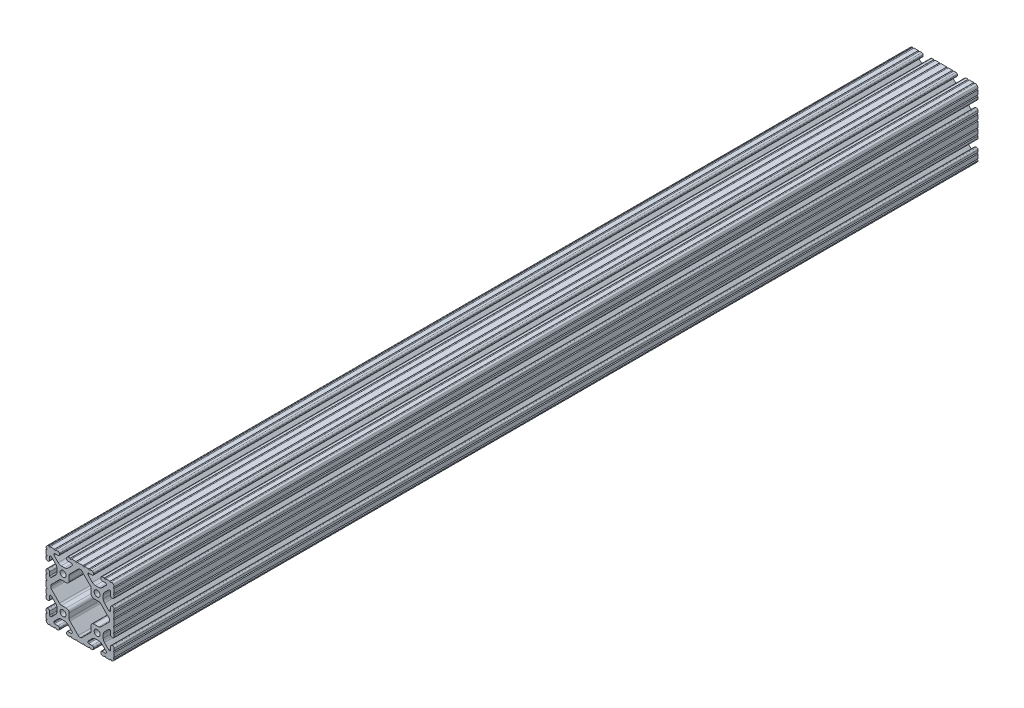
from build123d import *

# Parameters (mm, degrees)
SKETCH1_R           = 3.3274
BOSS_EXTRUDE1_DEPTH = 965.2


with BuildPart() as part:
    # Sketch1 → Boss-Extrude1 (new body)
    with BuildSketch(Plane(origin=(0, 0, -609.6), x_dir=(-1, 0, 0), z_dir=(0, 0, -1))):
        with BuildLine():
            Line((36.525200182, -23.055396049), (35.610799999, -23.055396049))
            ThreePointArc((35.610799999, -23.055396049), (34.49724824, -23.51664429), (34.035999999, -24.630196049))
            Line((34.035999999, -24.630196049), (34.035999999, -28.448000001))
            ThreePointArc((34.035999999, -28.448000001), (33.775617927, -29.07661793), (33.146999999, -29.337000001))
            Line((33.146999999, -29.337000001), (32.664287243, -29.337000001))
            ThreePointArc((32.664287243, -29.337000001), (32.324081166, -29.269328696), (32.035668541, -29.076617157))
            Line((32.035668541, -29.076617157), (27.197580079, -24.238516795))
            ThreePointArc((27.197580079, -24.238516795), (26.167955878, -22.697572205), (25.806399999, -20.879905136))
            Line((25.806399999, -20.879905136), (25.806399999, -17.220094864))
            ThreePointArc((25.806399999, -17.220094864), (26.167955878, -15.402427795), (27.197580079, -13.861483205))
            Line((27.197580079, -13.861483205), (31.948944539, -9.110107059))
            ThreePointArc((31.948944539, -9.110107059), (32.333417094, -8.853210197), (32.786933647, -8.763000001))
            Line((32.786933647, -8.763000001), (33.060275786, -8.763000001))
            ThreePointArc((33.060275786, -8.763000001), (33.750216993, -9.048783007), (34.035999999, -9.738724214))
            Line((34.035999999, -9.738724214), (34.035999999, -13.469803585))
            ThreePointArc((34.035999999, -13.469803585), (34.497248347, -14.583355602), (35.610800365, -15.044603951))
            Line((35.610800365, -15.044603951), (36.525199999, -15.044603951))
            ThreePointArc((36.525199999, -15.044603951), (37.638751758, -14.58335571), (38.099999999, -13.469803951))
            Line((38.099999999, -13.469803951), (38.099999999, -11.075039291))
            ThreePointArc((38.099999999, -11.075039291), (37.117000249, -10.313517274), (38.099999999, -9.551995256))
            Line((38.099999999, -9.551995256), (38.099999999, -4.723759309))
            ThreePointArc((38.099999999, -4.723759309), (37.117000249, -3.962237291), (38.099999999, -3.200715274))
            Line((38.099999999, -3.200715274), (38.099999999, 3.200715274))
            ThreePointArc((38.099999999, 3.200715274), (37.117000249, 3.962237291), (38.099999999, 4.723759309))
            Line((38.099999999, 4.723759309), (38.099999999, 9.551995254))
            ThreePointArc((38.099999999, 9.551995254), (37.117000249, 10.313517271), (38.099999999, 11.075039288))
            Line((38.099999999, 11.075039288), (38.099999999, 13.469803951))
            ThreePointArc((38.099999999, 13.469803951), (37.638751758, 14.58335571), (36.525199999, 15.044603951))
            Line((36.525199999, 15.044603951), (35.610800365, 15.044603951))
            ThreePointArc((35.610800365, 15.044603951), (34.497248347, 14.583355602), (34.035999999, 13.469803585))
            Line((34.035999999, 13.469803585), (34.035999999, 9.738724211))
            ThreePointArc((34.035999999, 9.738724211), (33.750216993, 9.048783004), (33.060275786, 8.762999999))
            Line((33.060275786, 8.762999999), (32.78693365, 8.762999999))
            ThreePointArc((32.78693365, 8.762999999), (32.333417097, 8.853210195), (31.948944542, 9.110107056))
            Line((31.948944542, 9.110107056), (27.197580079, 13.861483205))
            ThreePointArc((27.197580079, 13.861483205), (26.167955878, 15.402427795), (25.806399999, 17.220094864))
            Line((25.806399999, 17.220094864), (25.806399999, 20.879905136))
            ThreePointArc((25.806399999, 20.879905136), (26.167955878, 22.697572205), (27.19758008, 24.238516796))
            Line((27.19758008, 24.238516796), (32.035668541, 29.076617154))
            ThreePointArc((32.035668541, 29.076617154), (32.324081166, 29.269328694), (32.664287243, 29.336999999))
            Line((32.664287243, 29.336999999), (33.146999999, 29.336999999))
            ThreePointArc((33.146999999, 29.336999999), (33.775617927, 29.076617927), (34.035999999, 28.447999999))
            Line((34.035999999, 28.447999999), (34.035999999, 24.630196049))
            ThreePointArc((34.035999999, 24.630196049), (34.49724824, 23.51664429), (35.610799999, 23.055396049))
            Line((35.610799999, 23.055396049), (36.525200182, 23.055396049))
            ThreePointArc((36.525200182, 23.055396049), (37.638751811, 23.516644237), (38.099999999, 24.630195866))
            Line((38.099999999, 24.630195866), (38.099999999, 27.023826138))
            ThreePointArc((38.099999999, 27.023826138), (37.117780707, 27.7845421), (38.099999999, 28.545258063))
            Line((38.099999999, 28.545258063), (38.099999999, 33.373016026))
            ThreePointArc((38.099999999, 33.373016026), (37.141472622, 34.109236775), (38.1, 34.845457522))
            ThreePointArc((38.1, 34.845457522), (37.837757798, 36.120195039), (37.086123087, 37.182631848))
            ThreePointArc((37.086123087, 37.182631848), (36.106286535, 37.843374412), (34.952681874, 38.099999999))
            ThreePointArc((34.952681874, 38.099999999), (34.190730434, 37.320215334), (33.428778993, 38.099999999))
            Line((33.428778993, 38.099999999), (28.601105934, 38.099999999))
            ThreePointArc((28.601105934, 38.099999999), (27.83915858, 37.320219419), (27.077211226, 38.099999999))
            Line((27.077211226, 38.099999999), (24.688799999, 38.099999999))
            ThreePointArc((24.688799999, 38.099999999), (23.57524824, 37.638751758), (23.113999999, 36.525199999))
            Line((23.113999999, 36.525199999), (23.113999999, 35.610799999))
            ThreePointArc((23.113999999, 35.610799999), (23.57524824, 34.49724824), (24.688799999, 34.035999999))
            Line((24.688799999, 34.035999999), (28.447999999, 34.035999999))
            ThreePointArc((28.447999999, 34.035999999), (29.076617927, 33.775617927), (29.336999999, 33.146999999))
            Line((29.336999999, 33.146999999), (29.336999999, 32.720693457))
            ThreePointArc((29.336999999, 32.720693457), (29.326675076, 32.273872753), (29.100231244, 31.888543625))
            Line((29.100231244, 31.888543625), (24.409287498, 27.19758834))
            ThreePointArc((24.409287498, 27.19758834), (22.868340044, 26.167958113), (21.050667578, 25.806399999))
            Line((21.050667578, 25.806399999), (17.049332422, 25.806399999))
            ThreePointArc((17.049332422, 25.806399999), (15.231659956, 26.167958113), (13.690712502, 27.19758834))
            Line((13.690712502, 27.19758834), (9.023381297, 31.864931026))
            ThreePointArc((9.023381297, 31.864931026), (8.830670885, 32.153343115), (8.762999999, 32.493548181))
            Line((8.762999999, 32.493548181), (8.762999999, 33.146999999))
            ThreePointArc((8.762999999, 33.146999999), (9.02338207, 33.775617927), (9.651999999, 34.035999999))
            Line((9.651999999, 34.035999999), (13.411199999, 34.035999999))
            ThreePointArc((13.411199999, 34.035999999), (14.524751758, 34.49724824), (14.985999999, 35.610799999))
            Line((14.985999999, 35.610799999), (14.985999999, 36.525199999))
            ThreePointArc((14.985999999, 36.525199999), (14.524751758, 37.638751758), (13.411199999, 38.099999999))
            Line((13.411199999, 38.099999999), (11.128867073, 38.099999999))
            ThreePointArc((11.128867073, 38.099999999), (10.367071032, 37.320370692), (9.605274992, 38.099999999))
            Line((9.605274992, 38.099999999), (4.777313068, 38.099999999))
            ThreePointArc((4.777313068, 38.099999999), (4.015517027, 37.320370692), (3.253720987, 38.099999999))
            Line((3.253720987, 38.099999999), (-3.253720989, 38.099999999))
            ThreePointArc((-3.253720989, 38.099999999), (-4.01551703, 37.320370692), (-4.777313071, 38.099999999))
            Line((-4.777313071, 38.099999999), (-9.605274992, 38.099999999))
            ThreePointArc((-9.605274992, 38.099999999), (-10.367071032, 37.320370692), (-11.128867073, 38.099999999))
            Line((-11.128867073, 38.099999999), (-13.411200001, 38.099999999))
            ThreePointArc((-13.411200001, 38.099999999), (-14.52475176, 37.638751758), (-14.986000001, 36.525199999))
            Line((-14.986000001, 36.525199999), (-14.986000001, 35.610799999))
            ThreePointArc((-14.986000001, 35.610799999), (-14.52475176, 34.49724824), (-13.411200001, 34.035999999))
            Line((-13.411200001, 34.035999999), (-9.652000001, 34.035999999))
            ThreePointArc((-9.652000001, 34.035999999), (-9.023382073, 33.775617927), (-8.763000001, 33.146999999))
            Line((-8.763000001, 33.146999999), (-8.763000001, 32.493548178))
            ThreePointArc((-8.763000001, 32.493548178), (-8.830670888, 32.153343112), (-9.0233813, 31.864931023))
            Line((-9.0233813, 31.864931023), (-13.690712502, 27.19758834))
            ThreePointArc((-13.690712502, 27.19758834), (-15.231659956, 26.167958113), (-17.049332422, 25.806399999))
            Line((-17.049332422, 25.806399999), (-21.050667578, 25.806399999))
            ThreePointArc((-21.050667578, 25.806399999), (-22.868340044, 26.167958113), (-24.409287498, 27.19758834))
            Line((-24.409287498, 27.19758834), (-29.100231244, 31.888543625))
            ThreePointArc((-29.100231244, 31.888543625), (-29.326675074, 32.273872748), (-29.337000001, 32.720693446))
            Line((-29.337000001, 32.720693446), (-29.337000001, 33.146999999))
            ThreePointArc((-29.337000001, 33.146999999), (-29.07661793, 33.775617927), (-28.448000001, 34.035999999))
            Line((-28.448000001, 34.035999999), (-24.688800001, 34.035999999))
            ThreePointArc((-24.688800001, 34.035999999), (-23.575248242, 34.49724824), (-23.114000001, 35.610799999))
            Line((-23.114000001, 35.610799999), (-23.114000001, 36.525199999))
            ThreePointArc((-23.114000001, 36.525199999), (-23.575248242, 37.638751758), (-24.688800001, 38.099999999))
            Line((-24.688800001, 38.099999999), (-27.077211226, 38.099999999))
            ThreePointArc((-27.077211226, 38.099999999), (-27.83915858, 37.320219419), (-28.601105934, 38.099999999))
            Line((-28.601105934, 38.099999999), (-33.428778993, 38.099999999))
            ThreePointArc((-33.428778993, 38.099999999), (-34.190730434, 37.320215334), (-34.952681874, 38.099999999))
            ThreePointArc((-34.952681874, 38.099999999), (-36.106286561, 37.843374402), (-37.086123128, 37.18263181))
            ThreePointArc((-37.086123128, 37.18263181), (-37.837757809, 36.120195013), (-38.1, 34.845457522))
            ThreePointArc((-38.1, 34.845457522), (-37.141472622, 34.109236773), (-38.100000001, 33.373016026))
            Line((-38.100000001, 33.373016026), (-38.100000001, 28.545258062))
            ThreePointArc((-38.100000001, 28.545258062), (-37.117780707, 27.7845421), (-38.100000001, 27.023826138))
            Line((-38.100000001, 27.023826138), (-38.100000001, 24.630195866))
            ThreePointArc((-38.100000001, 24.630195866), (-37.638751814, 23.516644237), (-36.525200184, 23.055396049))
            Line((-36.525200184, 23.055396049), (-35.610800001, 23.055396049))
            ThreePointArc((-35.610800001, 23.055396049), (-34.497248242, 23.51664429), (-34.036000001, 24.630196049))
            Line((-34.036000001, 24.630196049), (-34.036000001, 28.447999999))
            ThreePointArc((-34.036000001, 28.447999999), (-33.77561793, 29.076617927), (-33.147000001, 29.336999999))
            Line((-33.147000001, 29.336999999), (-32.664287243, 29.336999999))
            ThreePointArc((-32.664287243, 29.336999999), (-32.324081166, 29.269328694), (-32.035668541, 29.076617154))
            Line((-32.035668541, 29.076617154), (-27.197580082, 24.238516798))
            ThreePointArc((-27.197580082, 24.238516798), (-26.16795588, 22.697572208), (-25.806400001, 20.879905138))
            Line((-25.806400001, 20.879905138), (-25.806400001, 17.220094862))
            ThreePointArc((-25.806400001, 17.220094862), (-26.16795588, 15.402427793), (-27.197580082, 13.861483203))
            Line((-27.197580082, 13.861483203), (-31.948944542, 9.110107056))
            ThreePointArc((-31.948944542, 9.110107056), (-32.333417097, 8.853210195), (-32.78693365, 8.762999999))
            Line((-32.78693365, 8.762999999), (-33.060275789, 8.762999999))
            ThreePointArc((-33.060275789, 8.762999999), (-33.750216996, 9.048783004), (-34.036000001, 9.738724211))
            Line((-34.036000001, 9.738724211), (-34.036000001, 13.469803585))
            ThreePointArc((-34.036000001, 13.469803585), (-34.497248349, 14.583355602), (-35.610800367, 15.044603951))
            Line((-35.610800367, 15.044603951), (-36.525200001, 15.044603951))
            ThreePointArc((-36.525200001, 15.044603951), (-37.63875176, 14.58335571), (-38.100000001, 13.469803951))
            Line((-38.100000001, 13.469803951), (-38.100000001, 11.075039288))
            ThreePointArc((-38.100000001, 11.075039288), (-37.117000249, 10.313517271), (-38.100000001, 9.551995254))
            Line((-38.100000001, 9.551995254), (-38.100000001, 4.723759308))
            ThreePointArc((-38.100000001, 4.723759308), (-37.117000249, 3.962237291), (-38.100000001, 3.200715275))
            Line((-38.100000001, 3.200715275), (-38.100000001, -3.200715275))
            ThreePointArc((-38.100000001, -3.200715275), (-37.117000249, -3.962237291), (-38.100000001, -4.723759308))
            Line((-38.100000001, -4.723759308), (-38.100000001, -9.551995257))
            ThreePointArc((-38.100000001, -9.551995257), (-37.117000249, -10.313517274), (-38.100000001, -11.07503929))
            Line((-38.100000001, -11.07503929), (-38.100000001, -13.469803951))
            ThreePointArc((-38.100000001, -13.469803951), (-37.63875176, -14.58335571), (-36.525200001, -15.044603951))
            Line((-36.525200001, -15.044603951), (-35.610800367, -15.044603951))
            ThreePointArc((-35.610800367, -15.044603951), (-34.497248349, -14.583355602), (-34.036000001, -13.469803585))
            Line((-34.036000001, -13.469803585), (-34.036000001, -9.738724214))
            ThreePointArc((-34.036000001, -9.738724214), (-33.750216996, -9.048783007), (-33.060275789, -8.763000001))
            Line((-33.060275789, -8.763000001), (-32.786933647, -8.763000001))
            ThreePointArc((-32.786933647, -8.763000001), (-32.333417094, -8.853210197), (-31.948944539, -9.110107059))
            Line((-31.948944539, -9.110107059), (-27.197580082, -13.861483203))
            ThreePointArc((-27.197580082, -13.861483203), (-26.16795588, -15.402427793), (-25.806400001, -17.220094862))
            Line((-25.806400001, -17.220094862), (-25.806400001, -20.879905138))
            ThreePointArc((-25.806400001, -20.879905138), (-26.16795588, -22.697572207), (-27.197580082, -24.238516797))
            Line((-27.197580082, -24.238516797), (-32.035668541, -29.076617157))
            ThreePointArc((-32.035668541, -29.076617157), (-32.324081166, -29.269328696), (-32.664287243, -29.337000001))
            Line((-32.664287243, -29.337000001), (-33.147000001, -29.337000001))
            ThreePointArc((-33.147000001, -29.337000001), (-33.77561793, -29.07661793), (-34.036000001, -28.448000001))
            Line((-34.036000001, -28.448000001), (-34.036000001, -24.630196049))
            ThreePointArc((-34.036000001, -24.630196049), (-34.497248242, -23.51664429), (-35.610800001, -23.055396049))
            Line((-35.610800001, -23.055396049), (-36.525200184, -23.055396049))
            ThreePointArc((-36.525200184, -23.055396049), (-37.638751814, -23.516644237), (-38.100000001, -24.630195866))
            Line((-38.100000001, -24.630195866), (-38.100000001, -27.023826138))
            ThreePointArc((-38.100000001, -27.023826138), (-37.117780707, -27.7845421), (-38.100000001, -28.545258062))
            Line((-38.100000001, -28.545258062), (-38.100000001, -33.373016026))
            ThreePointArc((-38.100000001, -33.373016026), (-37.141472622, -34.109236773), (-38.1, -34.845457522))
            ThreePointArc((-38.1, -34.845457522), (-37.83775782, -36.120194987), (-37.086123169, -37.182631771))
            ThreePointArc((-37.086123169, -37.182631771), (-36.106286588, -37.843374393), (-34.952681874, -38.100000001))
            ThreePointArc((-34.952681874, -38.100000001), (-34.190730434, -37.320215336), (-33.428778993, -38.100000001))
            Line((-33.428778993, -38.100000001), (-28.601105934, -38.100000001))
            ThreePointArc((-28.601105934, -38.100000001), (-27.83915858, -37.320219421), (-27.077211226, -38.100000001))
            Line((-27.077211226, -38.100000001), (-24.688800001, -38.100000001))
            ThreePointArc((-24.688800001, -38.100000001), (-23.575248242, -37.63875176), (-23.114000001, -36.525200001))
            Line((-23.114000001, -36.525200001), (-23.114000001, -35.610800001))
            ThreePointArc((-23.114000001, -35.610800001), (-23.575248242, -34.497248242), (-24.688800001, -34.036000001))
            Line((-24.688800001, -34.036000001), (-28.448000001, -34.036000001))
            ThreePointArc((-28.448000001, -34.036000001), (-29.07661793, -33.77561793), (-29.337000001, -33.147000001))
            Line((-29.337000001, -33.147000001), (-29.337000001, -32.720693446))
            ThreePointArc((-29.337000001, -32.720693446), (-29.326675074, -32.273872748), (-29.100231244, -31.888543625))
            Line((-29.100231244, -31.888543625), (-24.409287501, -27.197588343))
            ThreePointArc((-24.409287501, -27.197588343), (-22.868340046, -26.167958116), (-21.050667581, -25.806400001))
            Line((-21.050667581, -25.806400001), (-17.049332419, -25.806400001))
            ThreePointArc((-17.049332419, -25.806400001), (-15.231659954, -26.167958116), (-13.690712499, -27.197588343))
            Line((-13.690712499, -27.197588343), (-9.0233813, -31.864931023))
            ThreePointArc((-9.0233813, -31.864931023), (-8.830670888, -32.153343112), (-8.763000001, -32.493548178))
            Line((-8.763000001, -32.493548178), (-8.763000001, -33.147000001))
            ThreePointArc((-8.763000001, -33.147000001), (-9.023382073, -33.77561793), (-9.652000001, -34.036000001))
            Line((-9.652000001, -34.036000001), (-13.411200001, -34.036000001))
            ThreePointArc((-13.411200001, -34.036000001), (-14.52475176, -34.497248242), (-14.986000001, -35.610800001))
            Line((-14.986000001, -35.610800001), (-14.986000001, -36.525200001))
            ThreePointArc((-14.986000001, -36.525200001), (-14.52475176, -37.63875176), (-13.411200001, -38.100000001))
            Line((-13.411200001, -38.100000001), (-11.128867073, -38.100000001))
            ThreePointArc((-11.128867073, -38.100000001), (-10.367071032, -37.320370694), (-9.605274992, -38.100000001))
            Line((-9.605274992, -38.100000001), (-4.777313071, -38.100000001))
            ThreePointArc((-4.777313071, -38.100000001), (-4.01551703, -37.320370694), (-3.253720989, -38.100000001))
            Line((-3.253720989, -38.100000001), (3.253720987, -38.100000001))
            ThreePointArc((3.253720987, -38.100000001), (4.015517027, -37.320370694), (4.777313068, -38.100000001))
            Line((4.777313068, -38.100000001), (9.605274992, -38.100000001))
            ThreePointArc((9.605274992, -38.100000001), (10.367071032, -37.320370694), (11.128867073, -38.100000001))
            Line((11.128867073, -38.100000001), (13.411199999, -38.100000001))
            ThreePointArc((13.411199999, -38.100000001), (14.524751758, -37.63875176), (14.985999999, -36.525200001))
            Line((14.985999999, -36.525200001), (14.985999999, -35.610800001))
            ThreePointArc((14.985999999, -35.610800001), (14.524751758, -34.497248242), (13.411199999, -34.036000001))
            Line((13.411199999, -34.036000001), (9.651999999, -34.036000001))
            ThreePointArc((9.651999999, -34.036000001), (9.02338207, -33.77561793), (8.762999999, -33.147000001))
            Line((8.762999999, -33.147000001), (8.762999999, -32.493548181))
            ThreePointArc((8.762999999, -32.493548181), (8.830670885, -32.153343115), (9.023381297, -31.864931026))
            Line((9.023381297, -31.864931026), (13.690712499, -27.197588343))
            ThreePointArc((13.690712499, -27.197588343), (15.231659954, -26.167958116), (17.049332419, -25.806400001))
            Line((17.049332419, -25.806400001), (21.050667581, -25.806400001))
            ThreePointArc((21.050667581, -25.806400001), (22.868340046, -26.167958116), (24.409287501, -27.197588343))
            Line((24.409287501, -27.197588343), (29.100231244, -31.888543625))
            ThreePointArc((29.100231244, -31.888543625), (29.326675076, -32.273872753), (29.336999999, -32.720693457))
            Line((29.336999999, -32.720693457), (29.336999999, -33.147000001))
            ThreePointArc((29.336999999, -33.147000001), (29.076617927, -33.77561793), (28.447999999, -34.036000001))
            Line((28.447999999, -34.036000001), (24.688799999, -34.036000001))
            ThreePointArc((24.688799999, -34.036000001), (23.57524824, -34.497248242), (23.113999999, -35.610800001))
            Line((23.113999999, -35.610800001), (23.113999999, -36.525200001))
            ThreePointArc((23.113999999, -36.525200001), (23.57524824, -37.63875176), (24.688799999, -38.100000001))
            Line((24.688799999, -38.100000001), (27.077211226, -38.100000001))
            ThreePointArc((27.077211226, -38.100000001), (27.83915858, -37.320219421), (28.601105934, -38.100000001))
            Line((28.601105934, -38.100000001), (33.428778993, -38.100000001))
            ThreePointArc((33.428778993, -38.100000001), (34.190730434, -37.320215336), (34.952681874, -38.100000001))
            ThreePointArc((34.952681874, -38.100000001), (36.106286561, -37.843374403), (37.086123128, -37.182631809))
            ThreePointArc((37.086123128, -37.182631809), (37.837757809, -36.120195013), (38.1, -34.845457522))
            ThreePointArc((38.1, -34.845457522), (37.141472622, -34.109236775), (38.099999999, -33.373016026))
            Line((38.099999999, -33.373016026), (38.099999999, -28.545258063))
            ThreePointArc((38.099999999, -28.545258063), (37.117780707, -27.7845421), (38.099999999, -27.023826138))
            Line((38.099999999, -27.023826138), (38.099999999, -24.630195866))
            ThreePointArc((38.099999999, -24.630195866), (37.638751811, -23.516644237), (36.525200182, -23.055396049))
        make_face()
        with Locations((19.049999999, -19.050000001)):
            Circle(SKETCH1_R, mode=Mode.SUBTRACT)
        with Locations((19.049999999, 19.049999999)):
            Circle(SKETCH1_R, mode=Mode.SUBTRACT)
        with Locations((-19.050000001, 19.049999999)):
            Circle(SKETCH1_R, mode=Mode.SUBTRACT)
        with Locations((-19.050000001, -19.050000001)):
            Circle(SKETCH1_R, mode=Mode.SUBTRACT)
        with BuildLine():
            Line((31.902125566, -2.475607376), (23.014093535, -11.36366127))
            ThreePointArc((23.014093535, -11.36366127), (21.984048445, -12.05191677), (20.769026744, -12.293600001))
            Line((20.769026744, -12.293600001), (15.468599999, -12.293600001))
            ThreePointArc((15.468599999, -12.293600001), (13.223535968, -13.223535971), (12.293599999, -15.468600001))
            Line((12.293599999, -15.468600001), (12.293599999, -20.598259734))
            ThreePointArc((12.293599999, -20.598259734), (12.051918262, -21.813277828), (11.36366679, -22.843321004))
            Line((11.36366679, -22.843321004), (2.051515951, -32.155494748))
            ThreePointArc((2.051515951, -32.155494748), (1.11031328, -32.786013752), (0, -33.011005091))
            ThreePointArc((0, -33.011005091), (-1.11031328, -32.786013752), (-2.051515951, -32.155494748))
            Line((-2.051515951, -32.155494748), (-11.363666793, -22.843321001))
            ThreePointArc((-11.363666793, -22.843321001), (-12.051918264, -21.813277826), (-12.293600001, -20.598259732))
            Line((-12.293600001, -20.598259732), (-12.293600001, -15.468600001))
            ThreePointArc((-12.293600001, -15.468600001), (-13.223535971, -13.223535971), (-15.468600001, -12.293600001))
            Line((-15.468600001, -12.293600001), (-20.769026744, -12.293600001))
            ThreePointArc((-20.769026744, -12.293600001), (-21.984048445, -12.05191677), (-23.014093535, -11.36366127))
            Line((-23.014093535, -11.36366127), (-31.902125566, -2.475607376))
            ThreePointArc((-31.902125566, -2.475607376), (-32.607298578, -1.335259481), (-32.728725173, 0))
            ThreePointArc((-32.728725173, 0), (-32.607298578, 1.335259481), (-31.902125566, 2.475607376))
            Line((-31.902125566, 2.475607376), (-23.014093538, 11.363661268))
            ThreePointArc((-23.014093538, 11.363661268), (-21.984048448, 12.051916767), (-20.769026746, 12.293599999))
            Line((-20.769026746, 12.293599999), (-15.468600001, 12.293599999))
            ThreePointArc((-15.468600001, 12.293599999), (-13.223535971, 13.223535968), (-12.293600001, 15.468599999))
            Line((-12.293600001, 15.468599999), (-12.293600001, 20.598259732))
            ThreePointArc((-12.293600001, 20.598259732), (-12.051918264, 21.813277826), (-11.363666793, 22.843321001))
            Line((-11.363666793, 22.843321001), (-2.051515951, 32.155494748))
            ThreePointArc((-2.051515951, 32.155494748), (-1.11031328, 32.786013752), (0, 33.011005091))
            ThreePointArc((0, 33.011005091), (1.11031328, 32.786013752), (2.051515951, 32.155494748))
            Line((2.051515951, 32.155494748), (11.36366679, 22.843321004))
            ThreePointArc((11.36366679, 22.843321004), (12.051918262, 21.813277828), (12.293599999, 20.598259734))
            Line((12.293599999, 20.598259734), (12.293599999, 15.468599999))
            ThreePointArc((12.293599999, 15.468599999), (13.223535968, 13.223535968), (15.468599999, 12.293599999))
            Line((15.468599999, 12.293599999), (20.769026746, 12.293599999))
            ThreePointArc((20.769026746, 12.293599999), (21.984048448, 12.051916767), (23.014093538, 11.363661268))
            Line((23.014093538, 11.363661268), (31.902125566, 2.475607376))
            ThreePointArc((31.902125566, 2.475607376), (32.607298578, 1.335259481), (32.728725173, 0))
            ThreePointArc((32.728725173, 0), (32.607298578, -1.335259481), (31.902125566, -2.475607376))
        make_face(mode=Mode.SUBTRACT)
    extrude(amount=-BOSS_EXTRUDE1_DEPTH)


solid = part.part
